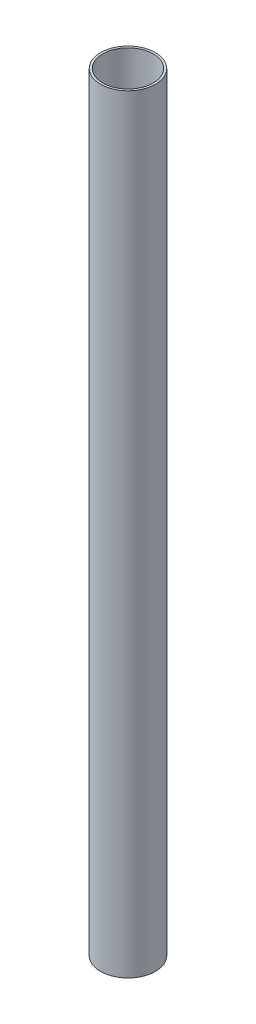
from build123d import *

# Parameters (mm, degrees)
SKETCH2_R           = 12.5
BOSS_EXTRUDE1_DEPTH = 350
SKETCH4_R           = 11.5
CUT_EXTRUDE1_DEPTH  = 351.446144222


with BuildPart() as part:
    # Sketch2 → Boss-Extrude1 (new body)
    with BuildSketch(Plane(origin=(0, 0, 0), x_dir=(1, 0, 0), z_dir=(0, 1, 0))):
        with Locations(Location((0, 0, 0), (0, 0, 270))):
            Circle(SKETCH2_R)
    extrude(amount=BOSS_EXTRUDE1_DEPTH)

    # Sketch4 → Cut-Extrude1 (cut, through all)
    with BuildSketch(Plane.XZ):
        with Locations(Location((0, 0, 0), (0, 0, 270))):
            Circle(SKETCH4_R)
    extrude(amount=-CUT_EXTRUDE1_DEPTH, mode=Mode.SUBTRACT)


solid = part.part
